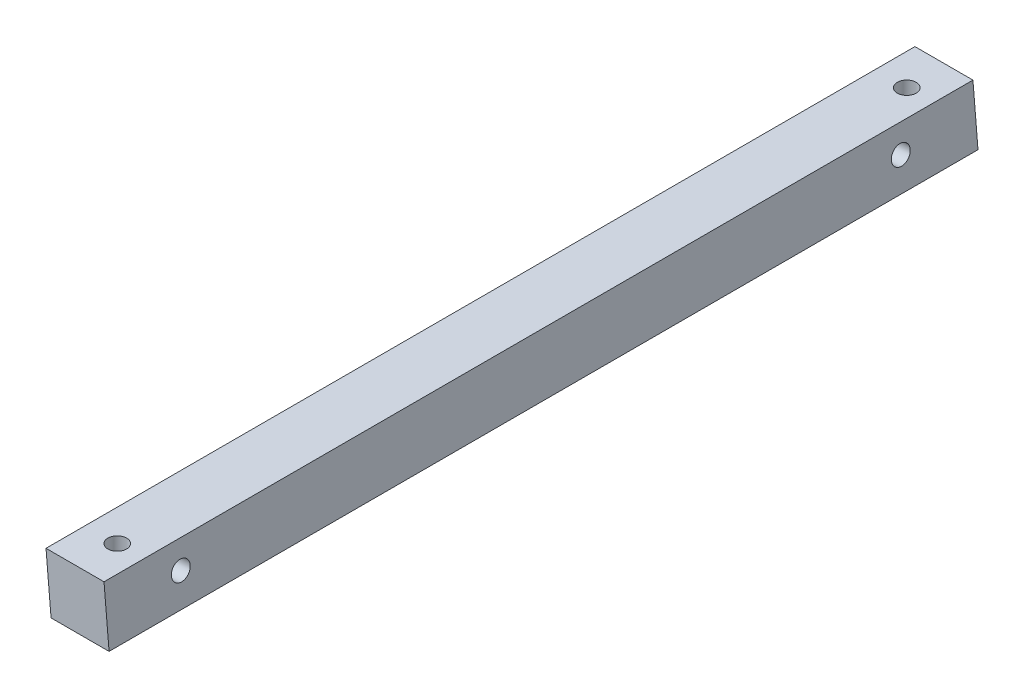
from build123d import *

# Parameters (mm, degrees)
BOSS_EXTRUDE1_DEPTH     = 175
SKETCH2_R               = 1.9
CUT_EXTRUDE1_DEPTH      = 176.775126352
CUT_EXTRUDE2_DEPTH      = 176.775126352
CUT_EXTRUDE2_DEPTH_BACK = 176.775126352
SKETCH3_R               = 1.9


with BuildPart() as part:
    # Sketch1 → Boss-Extrude1 (new body)
    with BuildSketch(Plane.XY):
        Polygon((0, 0), (11.68185891, 0), (10.66371782, 11.63740591), (-1.01814109, 11.63740591), align=None)
    extrude(amount=BOSS_EXTRUDE1_DEPTH)

    # Sketch2 → Cut-Extrude1 (cut, through all)
    with BuildSketch(Plane(origin=(0, 0, 0), x_dir=(1, 0, 0), z_dir=(0, 1, 0))):
        with Locations(Location((5.33185891, -8, 0), (0, 0, 270))):
            Circle(SKETCH2_R)
        with Locations(Location((5.33185891, -167, 0), (0, 0, 270))):
            Circle(SKETCH2_R)
    extrude(amount=CUT_EXTRUDE1_DEPTH, mode=Mode.SUBTRACT)

    # Sketch3 → Cut-Extrude2 (cut, two sides: drawn at the far end of the back side and taken through both)
    with BuildSketch(Plane(origin=(11.593122067, 1.014266756, 0), x_dir=(0, 0, -1), z_dir=(0.9961946980917453, 0.08715574274766183, 0)).offset(-CUT_EXTRUDE2_DEPTH_BACK)):
        with Locations(Location((-160, 5.33185891, 0), (0, 0, 90))):
            Circle(SKETCH3_R)
        with Locations(Location((-15, 5.33185891, 0), (0, 0, 90))):
            Circle(SKETCH3_R)
    extrude(amount=CUT_EXTRUDE2_DEPTH + CUT_EXTRUDE2_DEPTH_BACK, mode=Mode.SUBTRACT)


solid = part.part
